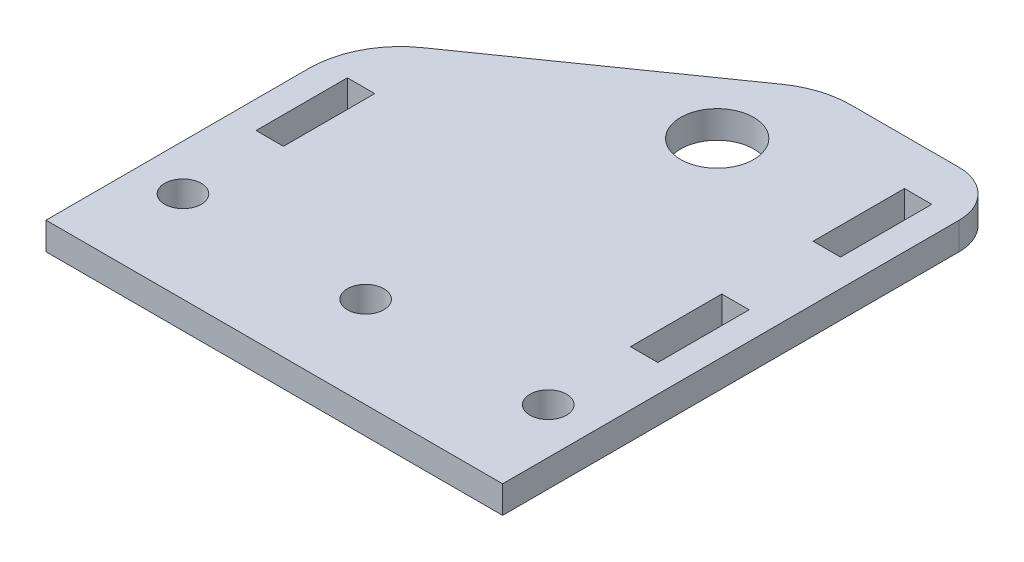
from build123d import *

# Parameters (mm, degrees)
SKETCH_1_W          = 50
SKETCH_1_H          = 55
EXTRUDE_1_DEPTH     = 3
SKETCH_2_R          = 4
CUT_EXTRUDE_1_DEPTH = 3
SKETCH_3_R          = 2
CUT_EXTRUDE_2_DEPTH = 3
SKETCH_4_W          = 3
SKETCH_4_H          = 10
CUT_EXTRUDE_3_DEPTH = 3
CHAMFER_1_SIZE      = 30
CHAMFER_1_SIZE2     = 21.006226146
FILLET_2_R          = 10
FILLET_3_R          = 5


with BuildPart() as part:
    # 草图1 → 凸台-拉伸1 (new body)
    with BuildSketch(Plane(origin=(0, 0, 0), x_dir=(1, 0, 0), z_dir=(0, 1, 0))):
        Rectangle(SKETCH_1_W, SKETCH_1_H)
    extrude(amount=EXTRUDE_1_DEPTH)

    # 草图2 → 切除-拉伸1 (cut)
    with BuildSketch(Plane(origin=(0, 3, 0), x_dir=(1, 0, 0), z_dir=(0, 1, 0))):
        with Locations(Location((4, 17, 0), (0, 0, 270))):
            Circle(SKETCH_2_R)
    extrude(amount=-CUT_EXTRUDE_1_DEPTH, mode=Mode.SUBTRACT)

    # 草图3 → 切除-拉伸2 (cut)
    with BuildSketch(Plane(origin=(0, 3, 0), x_dir=(1, 0, 0), z_dir=(0, 1, 0))):
        with Locations(Location((-20, -17.5, 0), (0, 0, 270))):
            Circle(SKETCH_3_R)
        with Locations(Location((0, -17.5, 0), (0, 0, 270))):
            Circle(SKETCH_3_R)
        with Locations(Location((20, -17.5, 0), (0, 0, 90))):
            Circle(SKETCH_3_R)
    extrude(amount=-CUT_EXTRUDE_2_DEPTH, mode=Mode.SUBTRACT)

    # 草图4 → 切除-拉伸3 (cut)
    with BuildSketch(Plane(origin=(0, 3, 0), x_dir=(1, 0, 0), z_dir=(0, 1, 0))):
        with Locations((-20.5, -2.5)):
            Rectangle(SKETCH_4_W, SKETCH_4_H)
        with Locations((20.5, -2.5)):
            Rectangle(SKETCH_4_W, SKETCH_4_H)
        with Locations((20.5, 17.5)):
            Rectangle(SKETCH_4_W, SKETCH_4_H)
    extrude(amount=-CUT_EXTRUDE_3_DEPTH, mode=Mode.SUBTRACT)

    # 倒角1
    chamfer_1_edges = [part.edges().sort_by_distance(p)[0] for p in [
        (-25, 1.5, -27.5),
    ]]
    chamfer_1_side = [part.faces().sort_by_distance(p)[0] for p in [
        (0, 1.5, -27.5),
    ]]
    chamfer(chamfer_1_edges, length=CHAMFER_1_SIZE, length2=CHAMFER_1_SIZE2, reference=chamfer_1_side[0])

    # 圆角2
    fillet_2_edges = [part.edges().sort_by_distance(p)[0] for p in [
        (-25, 1.5, -6.493773854),
        (5, 1.5, -27.5),
    ]]
    fillet(fillet_2_edges, radius=FILLET_2_R)

    # 圆角3
    fillet_3_edges = [part.edges().sort_by_distance(p)[0] for p in [
        (25, 1.5, -27.5),
    ]]
    fillet(fillet_3_edges, radius=FILLET_3_R)


solid = part.part
